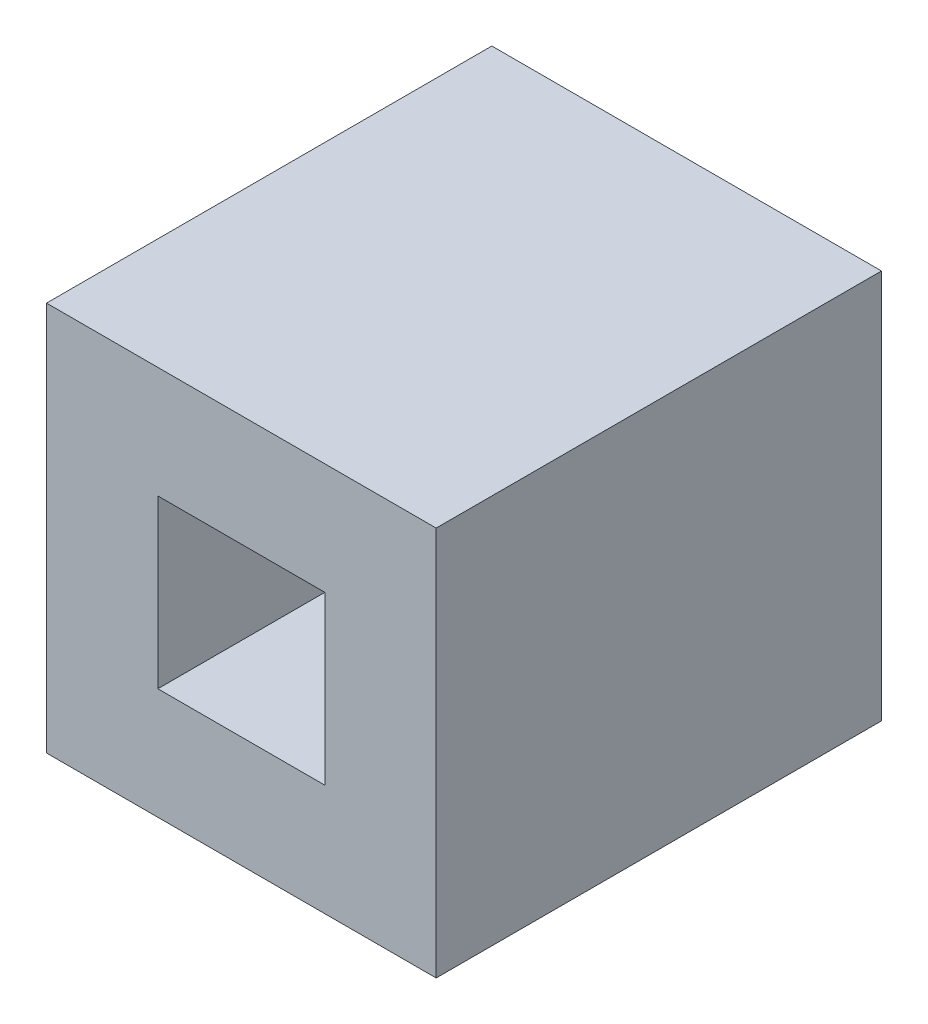
from build123d import *

# Parameters (mm, degrees)
SKETCH_1_W      = 35
SKETCH_1_H      = 35
SKETCH_1_W_2    = 15
SKETCH_1_H_2    = 15
EXTRUDE_1_DEPTH = 40


with BuildPart() as part:
    # 草图1 → 凸台-拉伸1 (new body)
    with BuildSketch(Plane.XY):
        Rectangle(SKETCH_1_W, SKETCH_1_H)
        Rectangle(SKETCH_1_W_2, SKETCH_1_H_2, mode=Mode.SUBTRACT)
    extrude(amount=EXTRUDE_1_DEPTH)


solid = part.part
